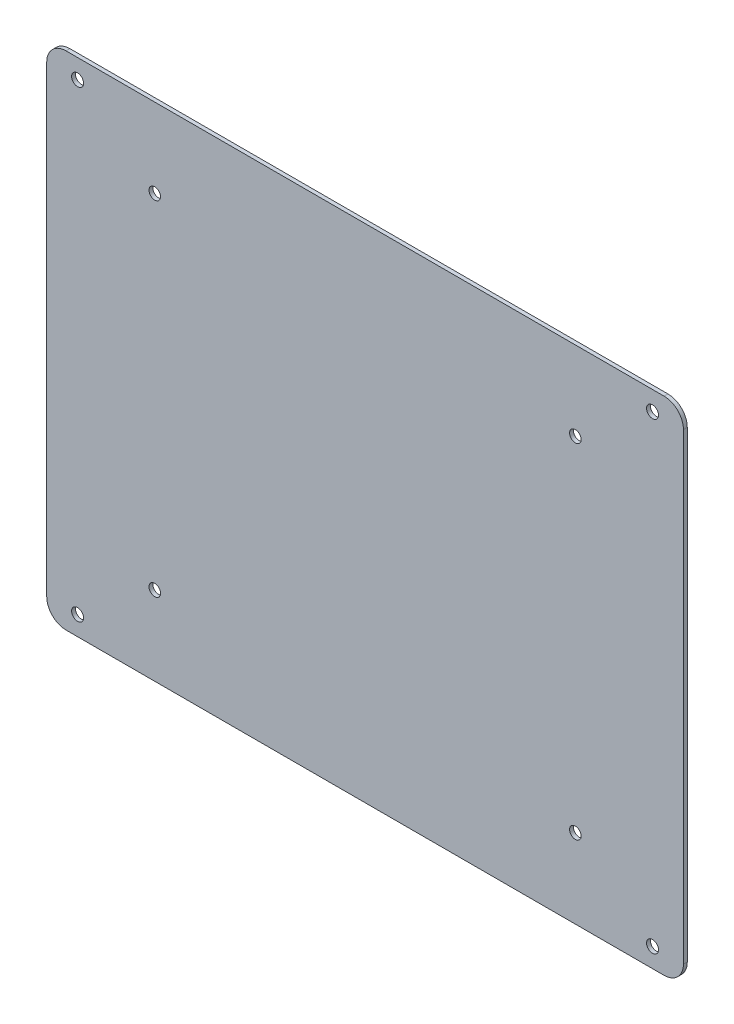
from build123d import *

# Parameters (mm, degrees)
SKETCH_1_R          = 1.55
EXTRUDE_1_DEPTH     = 1
SKETCH_2_R          = 1.5
CUT_EXTRUDE_1_DEPTH = 10


with BuildPart() as part:
    # 草图1 → 凸台-拉伸1 (new body)
    with BuildSketch(Plane.XY):
        with BuildLine():
            Line((-77.5, 65), (77.5, 65))
            ThreePointArc((77.5, 65), (81.035533906, 63.535533906), (82.5, 60))
            Line((82.5, 60), (82.5, -60))
            ThreePointArc((82.5, -60), (81.035533906, -63.535533906), (77.5, -65))
            Line((77.5, -65), (-77.5, -65))
            ThreePointArc((-77.5, -65), (-81.035533906, -63.535533906), (-82.5, -60))
            Line((-82.5, -60), (-82.5, 60))
            ThreePointArc((-82.5, 60), (-81.035533906, 63.535533906), (-77.5, 65))
        make_face()
        with Locations((-74.5, 60)):
            Circle(SKETCH_1_R, mode=Mode.SUBTRACT)
        with Locations((74.5, 60)):
            Circle(SKETCH_1_R, mode=Mode.SUBTRACT)
        with Locations((74.5, -60)):
            Circle(SKETCH_1_R, mode=Mode.SUBTRACT)
        with Locations((-74.5, -60)):
            Circle(SKETCH_1_R, mode=Mode.SUBTRACT)
    extrude(amount=EXTRUDE_1_DEPTH)

    # 草图2 → 切除-拉伸1 (cut)
    with BuildSketch(Plane.XY.offset(1)):
        with Locations((-54.5, 44.5)):
            Circle(SKETCH_2_R)
        with Locations((-54.5, -44.5)):
            Circle(SKETCH_2_R)
        with Locations((54.5, -44.5)):
            Circle(SKETCH_2_R)
        with Locations((54.5, 44.5)):
            Circle(SKETCH_2_R)
    extrude(amount=-CUT_EXTRUDE_1_DEPTH, mode=Mode.SUBTRACT)


solid = part.part
